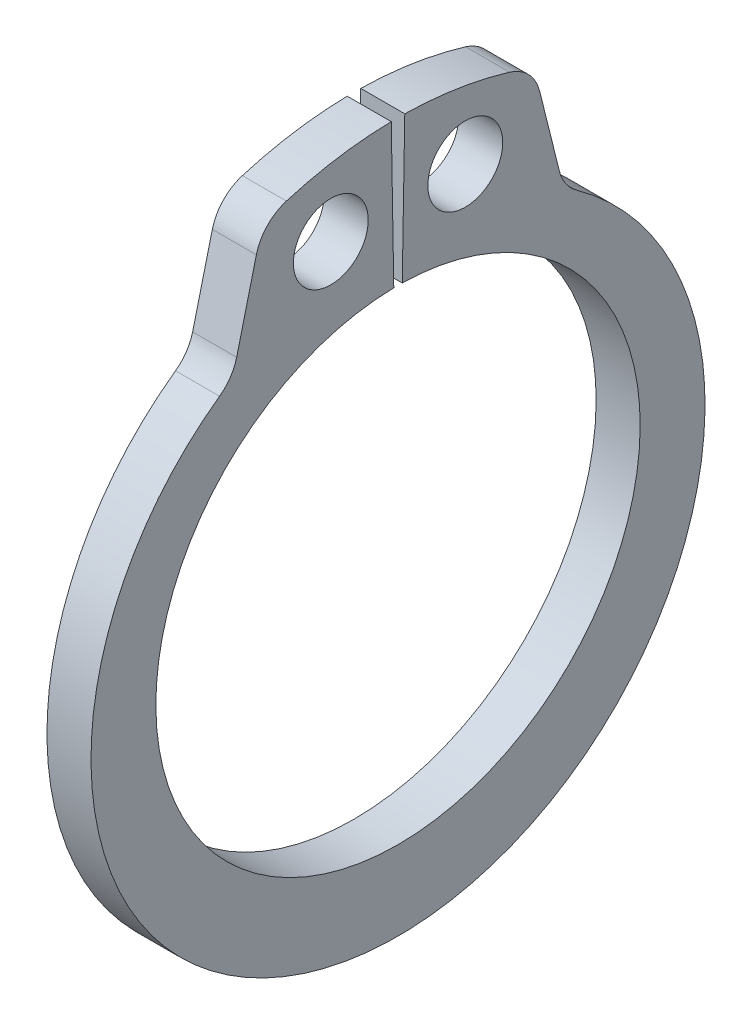
from build123d import *

# Parameters (mm, degrees)
SKETCH1_R      = 0.85
EXTRUDE1_DEPTH = 0.5
FILLET1_R      = 1


with BuildPart() as part:
    # Sketch1 → Extrude1 (new, symmetric)
    with BuildSketch(Plane(origin=(0, 0, 0), x_dir=(0, 0, -1), z_dir=(1, 0, 0))):
        with BuildLine():
            Line((-0.095988235, 5.499162323), (-0.153581177, 8.798659717))
            ThreePointArc((-0.153581177, 8.798659717), (-1.643106536, 8.645241518), (-3.085056855, 8.241506185))
            Line((-3.085056855, 8.241506185), (-3.756691586, 5.54772641))
            ThreePointArc((-3.756691586, 5.54772641), (0, -7.3), (3.756691586, 5.54772641))
            Line((3.756691586, 5.54772641), (3.085056855, 8.241506185))
            ThreePointArc((3.085056855, 8.241506185), (1.643106536, 8.645241518), (0.153581177, 8.798659717))
            Line((0.153581177, 8.798659717), (0.095988235, 5.499162323))
            ThreePointArc((0.095988235, 5.499162323), (0, -5.5), (-0.095988235, 5.499162323))
        make_face()
        with Locations((-1.527168783, 7.124432315)):
            Circle(SKETCH1_R, mode=Mode.SUBTRACT)
        with Locations((1.527168783, 7.124432315)):
            Circle(SKETCH1_R, mode=Mode.SUBTRACT)
    extrude(amount=EXTRUDE1_DEPTH, both=True)

    # Fillet1
    fillet1_edges = [part.edges().sort_by_distance(p)[0] for p in [
        (0, 8.241506185, -3.085056855),
        (0, 5.54772641, -3.756691586),
        (0, 5.54772641, 3.756691586),
        (0, 8.241506185, 3.085056855),
    ]]
    fillet(fillet1_edges, radius=FILLET1_R)


solid = part.part
